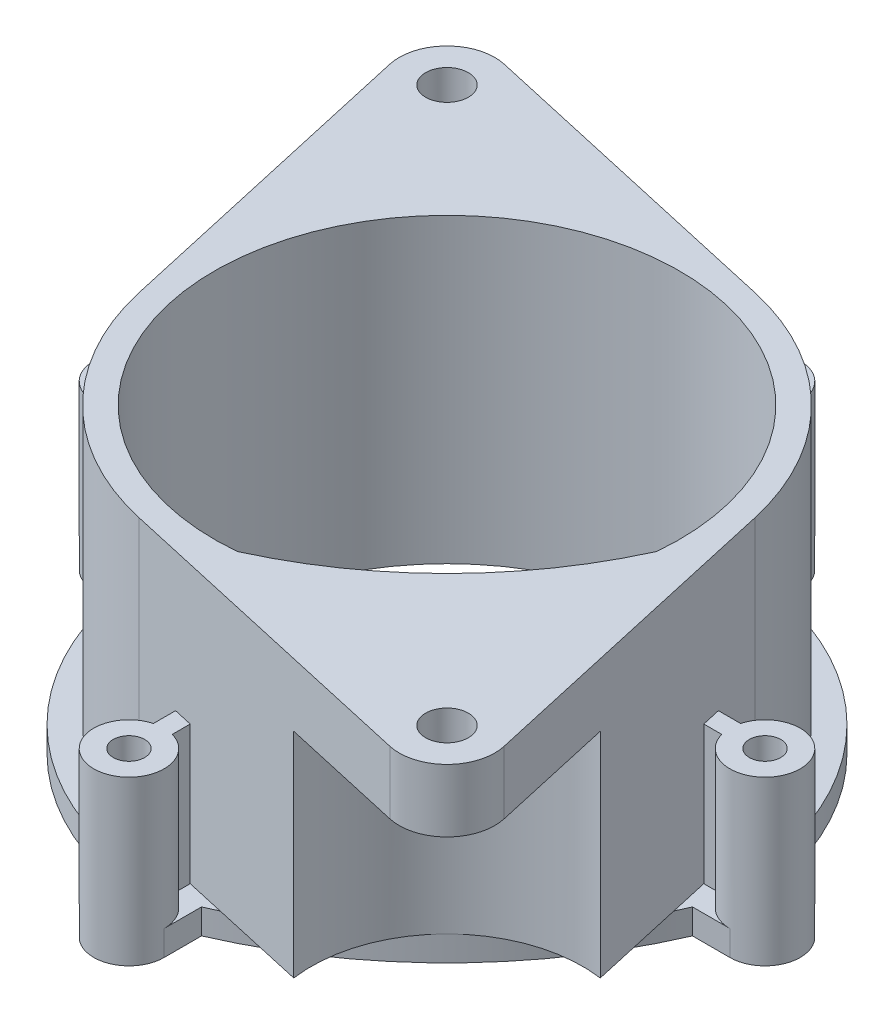
from build123d import *
from build123d.topology import SkipClean

# Parameters (mm, degrees)
EXTRUDE_1_DEPTH     = 2
EXTRUDE_2_DEPTH     = 17
EXTRUDE_3_DEPTH     = 5
HOLE_WIZARD_M31_D   = 3.4
EXTRUDE_4_DEPTH     = 11
CUT_EXTRUDE_1_DEPTH = 11
HOLE_WIZARD_M31_2_D = 2.5


with BuildPart() as part:
    # Эскиз1 → Бобышка-Вытянуть1 (new body)
    with BuildSketch(Plane(origin=(0, 0, 0), x_dir=(1, 0, 0), z_dir=(0, 1, 0))):
        with BuildLine():
            Line((22.325097984, -2.8), (25.3, -2.8))
            ThreePointArc((25.3, -2.8), (28.1, 0), (25.3, 2.8))
            Line((25.3, 2.8), (22.325097984, 2.8))
            ThreePointArc((22.325097984, 2.8), (15.909902577, 15.909902577), (2.8, 22.325097984))
            Line((2.8, 22.325097984), (2.8, 25.3))
            ThreePointArc((2.8, 25.3), (0, 28.1), (-2.8, 25.3))
            Line((-2.8, 25.3), (-2.8, 22.325097984))
            ThreePointArc((-2.8, 22.325097984), (-15.909902577, 15.909902577), (-22.325097984, 2.8))
            Line((-22.325097984, 2.8), (-25.3, 2.8))
            ThreePointArc((-25.3, 2.8), (-28.1, 0), (-25.3, -2.8))
            Line((-25.3, -2.8), (-22.325097984, -2.8))
            ThreePointArc((-22.325097984, -2.8), (-15.909902577, -15.909902577), (-2.8, -22.325097984))
            Line((-2.8, -22.325097984), (-2.8, -25.3))
            ThreePointArc((-2.8, -25.3), (0, -28.1), (2.8, -25.3))
            Line((2.8, -25.3), (2.8, -22.325097984))
            ThreePointArc((2.8, -22.325097984), (14.4243682, -14.4243682), (22.325097984, -2.8))
        make_face()
        with BuildLine():
            ThreePointArc((18.417505142, -1.745137346), (-13.081475452, 13.081475452), (1.745137346, -18.417505142))
            ThreePointArc((1.745137346, -18.417505142), (11.595941075, -11.595941075), (18.417505142, -1.745137346))
        make_face(mode=Mode.SUBTRACT)
    extrude(amount=EXTRUDE_1_DEPTH)

    # Эскиз2 → Бобышка-Вытянуть2 (add)
    with BuildSketch(Plane(origin=(0, 2, 0), x_dir=(1, 0, 0), z_dir=(0, 1, 0))):
        with BuildLine():
            Line((20.003268693, 4.485447761), (23.557492243, -11.364940531))
            ThreePointArc((23.557492243, -11.364940531), (14.4243682, -14.4243682), (11.364940531, -23.557492243))
            Line((11.364940531, -23.557492243), (-4.485447761, -20.003268693))
            ThreePointArc((-4.485447761, -20.003268693), (-14.495689014, -14.495689014), (-20.003268693, -4.485447761))
            Line((-20.003268693, -4.485447761), (-24.05725546, 13.593680769))
            ThreePointArc((-24.05725546, 13.593680769), (-15.909902577, 15.909902577), (-13.593680769, 24.05725546))
            Line((-13.593680769, 24.05725546), (4.485447761, 20.003268693))
            ThreePointArc((4.485447761, 20.003268693), (14.495689014, 14.495689014), (20.003268693, 4.485447761))
        make_face()
        with BuildLine():
            ThreePointArc((1.745137346, -18.417505142), (11.595941075, -11.595941075), (18.417505142, -1.745137346))
            ThreePointArc((18.417505142, -1.745137346), (-13.081475452, 13.081475452), (1.745137346, -18.417505142))
        make_face(mode=Mode.SUBTRACT)
    extrude(amount=EXTRUDE_2_DEPTH)

    # Эскиз3 → Бобышка-Вытянуть3 (add)
    with BuildSketch(Plane(origin=(0, 19, 0), x_dir=(1, 0, 0), z_dir=(0, 1, 0))):
        with BuildLine():
            Line((20.003268693, 4.485447761), (25.76965455, -21.23028272))
            ThreePointArc((25.76965455, -21.23028272), (24.748737342, -24.748737342), (21.23028272, -25.76965455))
            Line((21.23028272, -25.76965455), (-4.485447761, -20.003268693))
            ThreePointArc((-4.485447761, -20.003268693), (-14.495689014, -14.495689014), (-20.003268693, -4.485447761))
            Line((-20.003268693, -4.485447761), (-25.76965455, 21.23028272))
            ThreePointArc((-25.76965455, 21.23028272), (-24.748737342, 24.748737342), (-21.23028272, 25.76965455))
            Line((-21.23028272, 25.76965455), (4.485447761, 20.003268693))
            ThreePointArc((4.485447761, 20.003268693), (14.495689014, 14.495689014), (20.003268693, 4.485447761))
        make_face()
    extrude(amount=EXTRUDE_3_DEPTH)

    # Hole Wizard M31 (through all)
    with Locations(Plane(origin=(0, 0, 0), x_dir=(-1, 0, 0), z_dir=(0, -1, 0))):
        with Locations((-22.061731573, -22.061731573), (22.061731573, 22.061731573)):
            Hole(HOLE_WIZARD_M31_D / 2)

    # Эскиз6 → Бобышка-Вытянуть4 (add)
    with SkipClean():  # the faces are left unmerged after this step: merging them gives an invalid solid
        with BuildSketch(Plane(origin=(0, 2, 0), x_dir=(1, 0, 0), z_dir=(0, 1, 0))):
            with BuildLine():
                Line((0.75, 20.840889586), (-0.75, 21.177243196))
                Line((-0.75, 21.177243196), (-0.75, 22.602315808))
                ThreePointArc((-0.75, 22.602315808), (0, 28.1), (0.75, 22.602315808))
                Line((0.75, 22.602315808), (0.75, 20.840889586))
            make_face()
            with BuildLine():
                Line((-21.177243196, 0.75), (-22.602315808, 0.75))
                ThreePointArc((-22.602315808, 0.75), (-28.1, 0), (-22.602315808, -0.75))
                Line((-22.602315808, -0.75), (-20.840889586, -0.75))
                Line((-20.840889586, -0.75), (-21.177243196, 0.75))
            make_face()
            with BuildLine():
                Line((21.177243196, -0.75), (20.840889586, 0.75))
                Line((20.840889586, 0.75), (22.602315808, 0.75))
                ThreePointArc((22.602315808, 0.75), (28.1, 0), (22.602315808, -0.75))
                Line((22.602315808, -0.75), (21.177243196, -0.75))
            make_face()
            with BuildLine():
                Line((-0.75, -20.840889586), (0.75, -21.177243196))
                Line((0.75, -21.177243196), (0.75, -22.602315808))
                ThreePointArc((0.75, -22.602315808), (0, -28.1), (-0.75, -22.602315808))
                Line((-0.75, -22.602315808), (-0.75, -20.840889586))
            make_face()
        extrude(amount=EXTRUDE_4_DEPTH)

    # Эскиз7 → Вырез-Вытянуть1 (cut)
    with SkipClean():  # the faces are left unmerged after this step: merging them gives an invalid solid
        with BuildSketch(Plane.XZ.offset(-19)):
            with BuildLine():
                ThreePointArc((18.417505142, 1.745137346), (11.595941075, 11.595941075), (1.745137346, 18.417505142))
                ThreePointArc((1.745137346, 18.417505142), (-13.081475452, -13.081475452), (18.417505142, 1.745137346))
            make_face()
        extrude(amount=-CUT_EXTRUDE_1_DEPTH, mode=Mode.SUBTRACT)

    # Hole Wizard M31 2 (through all)
    with Locations(Plane(origin=(0, 0, 0), x_dir=(-1, 0, 0), z_dir=(0, -1, 0))):
        with Locations((0, -25.3), (-25.3, 0), (0, 25.3), (25.3, 0)):
            Hole(HOLE_WIZARD_M31_2_D / 2)


solid = part.part
